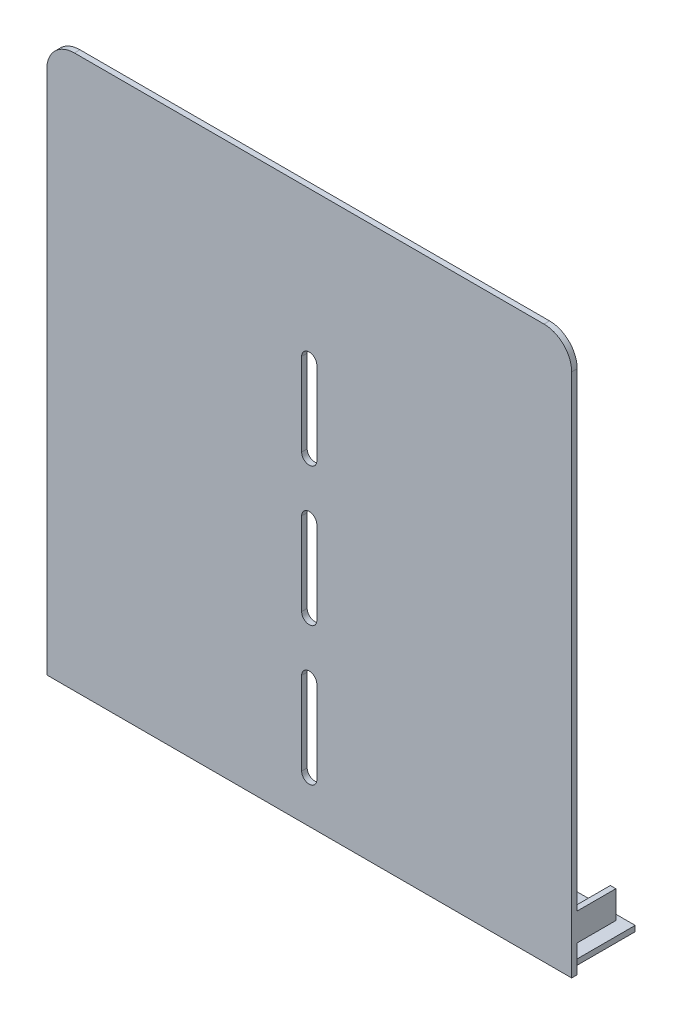
from build123d import *

# Parameters (mm, degrees)
SKETCH_1_W          = 190
SKETCH_1_H          = 200
EXTRUDE_1_DEPTH     = 2
SKETCH_2_W          = 42
SKETCH_2_H          = 24
EXTRUDE_2_DEPTH     = 2
SKETCH_12_W         = 14
SKETCH_12_H         = 10
EXTRUDE_5_DEPTH     = 2
SKETCH_15_W         = 14
SKETCH_15_H         = 15
EXTRUDE_9_DEPTH     = 2
SKETCH_15_3_W       = 2
SKETCH_15_3_H       = 15
EXTRUDE_10_DEPTH    = 190
CUT_EXTRUDE_1_DEPTH = 20
FILLET_1_R          = 10
SKETCH_20_W         = 14
SKETCH_20_H         = 125
CUT_EXTRUDE_4_DEPTH = 10
SKETCH_21_W         = 145
SKETCH_21_H         = 70
CUT_EXTRUDE_5_DEPTH = 2
SKETCH_22_W         = 2
SKETCH_22_H         = 10
EXTRUDE_11_DEPTH    = 14
SKETCH_23_W         = 15
SKETCH_23_H         = 16
EXTRUDE_12_DEPTH    = 2
SKETCH_25_W         = 15
SKETCH_25_H         = 2
EXTRUDE_13_DEPTH    = 43


with BuildPart() as part:
    # 草图1 → 凸台-拉伸1 (new body)
    with BuildSketch(Plane.XY):
        with Locations((95, 100)):
            Rectangle(SKETCH_1_W, SKETCH_1_H)
    extrude(amount=EXTRUDE_1_DEPTH)

    # 草图2 → 凸台-拉伸2 (add)
    with BuildSketch(Plane(origin=(0, 0, 0), x_dir=(1, 0, 0), z_dir=(0, 1, 0))):
        with Locations((24, 12)):
            Rectangle(SKETCH_2_W, SKETCH_2_H)
        with Locations((166, 12)):
            Rectangle(SKETCH_2_W, SKETCH_2_H)
    extrude(amount=EXTRUDE_2_DEPTH)

    # 草图15 → 凸台-拉伸9 (add)
    with BuildSketch(Plane(origin=(0, 0, 0), x_dir=(0, 0, -1), z_dir=(1, 0, 0))):
        with Locations((7, 127.5)):
            Rectangle(SKETCH_15_W, SKETCH_15_H)
        with Locations((7, 72.5)):
            Rectangle(SKETCH_15_W, SKETCH_15_H)
    extrude_9 = extrude(amount=EXTRUDE_9_DEPTH)

    # 草图15<3> → 凸台-拉伸10 (add)
    with BuildSketch(Plane(origin=(0, 0, 0), x_dir=(0, 0, -1), z_dir=(1, 0, 0))):
        with Locations((15, 127.5)):
            Rectangle(SKETCH_15_3_W, SKETCH_15_3_H)
        with Locations((15, 72.5)):
            Rectangle(SKETCH_15_3_W, SKETCH_15_3_H)
    extrude_10 = extrude(amount=EXTRUDE_10_DEPTH)

    # 草图17 → 切除-拉伸1 (cut)
    with BuildSketch(Plane(origin=(0, 0, 0), x_dir=(-1, 0, 0), z_dir=(0, 0, -1))):
        with BuildLine():
            Line((-95, 146), (-95, 116))
            Line((-95, 116), (-95, 113.25))
            ThreePointArc((-95, 113.25), (-93.055456352, 114.055456352), (-92.25, 116))
            Line((-92.25, 116), (-92.25, 146))
            ThreePointArc((-92.25, 146), (-93.055456352, 147.944543648), (-95, 148.75))
            Line((-95, 148.75), (-95, 146))
        make_face()
        with BuildLine():
            Line((-95, 113.25), (-95, 116))
            Line((-95, 116), (-95, 146))
            Line((-95, 146), (-95, 148.75))
            ThreePointArc((-95, 148.75), (-96.944543648, 147.944543648), (-97.75, 146))
            Line((-97.75, 146), (-97.75, 116))
            ThreePointArc((-97.75, 116), (-96.944543648, 114.055456352), (-95, 113.25))
        make_face()
        with BuildLine():
            Line((-95, 63.25), (-95, 98.75))
            ThreePointArc((-95, 98.75), (-96.944543648, 97.944543648), (-97.75, 96))
            Line((-97.75, 96), (-97.75, 66))
            ThreePointArc((-97.75, 66), (-96.944543648, 64.055456352), (-95, 63.25))
        make_face()
        with BuildLine():
            Line((-95, 13.25), (-95, 48.75))
            ThreePointArc((-95, 48.75), (-96.944543648, 47.944543648), (-97.75, 46))
            Line((-97.75, 46), (-97.75, 16))
            ThreePointArc((-97.75, 16), (-96.944543648, 14.055456352), (-95, 13.25))
        make_face()
        with BuildLine():
            ThreePointArc((-92.25, 46), (-93.055456352, 47.944543648), (-95, 48.75))
            Line((-95, 48.75), (-95, 13.25))
            ThreePointArc((-95, 13.25), (-93.055456352, 14.055456352), (-92.25, 16))
            Line((-92.25, 16), (-92.25, 46))
        make_face()
        with BuildLine():
            ThreePointArc((-92.25, 96), (-93.055456352, 97.944543648), (-95, 98.75))
            Line((-95, 98.75), (-95, 63.25))
            ThreePointArc((-95, 63.25), (-93.055456352, 64.055456352), (-92.25, 66))
            Line((-92.25, 66), (-92.25, 96))
        make_face()
    extrude(amount=-CUT_EXTRUDE_1_DEPTH, mode=Mode.SUBTRACT)

    # 圆角1
    fillet_1_edges = [part.edges().sort_by_distance(p)[0] for p in [
        (0, 200, 1),
        (190, 200, 1),
    ]]
    fillet(fillet_1_edges, radius=FILLET_1_R)

    # 镜向18: 凸台-拉伸9, 凸台-拉伸10 across plane
    add(extrude_9.mirror(Plane(origin=(95, 0, 0), x_dir=(0, 0, 1), z_dir=(1, 0, 0))))
    add(extrude_10.mirror(Plane(origin=(95, 0, 0), x_dir=(0, 0, 1), z_dir=(1, 0, 0))))


with BuildPart() as body_2:
    # 草图12 → 凸台-拉伸5 (new body)
    with BuildSketch(Plane(origin=(0, 0, 0), x_dir=(0, 0, -1), z_dir=(1, 0, 0))):
        with Locations((7, 15)):
            Rectangle(SKETCH_12_W, SKETCH_12_H)
    extrude_5 = extrude(amount=EXTRUDE_5_DEPTH)


with BuildPart() as part_1:
    add(part.part)

    # 镜向19: 凸台-拉伸5 across plane
    add(extrude_5.mirror(Plane(origin=(95, 0, 0), x_dir=(0, 0, 1), z_dir=(1, 0, 0))))

    # 草图20 → 切除-拉伸4 (cut)
    with BuildSketch(Plane(origin=(190, 0, 0), x_dir=(0, 0, -1), z_dir=(1, 0, 0))):
        with Locations((7, 72.5)):
            Rectangle(SKETCH_20_W, SKETCH_20_H)
    extrude(amount=-CUT_EXTRUDE_4_DEPTH, mode=Mode.SUBTRACT)

    # 草图21 → 切除-拉伸5 (cut)
    with BuildSketch(Plane(origin=(0, 0, -16), x_dir=(-1, 0, 0), z_dir=(0, 0, -1))):
        with Locations((-117.5, 100)):
            Rectangle(SKETCH_21_W, SKETCH_21_H)
    extrude(amount=-CUT_EXTRUDE_5_DEPTH, mode=Mode.SUBTRACT)

    # 草图22 → 凸台-拉伸11 (add)
    with BuildSketch(Plane(origin=(0, 0, 0), x_dir=(-1, 0, 0), z_dir=(0, 0, -1))):
        with Locations((-189, 15)):
            Rectangle(SKETCH_22_W, SKETCH_22_H)
    extrude(amount=EXTRUDE_11_DEPTH)

    # 草图23 → 凸台-拉伸12 (add)
    with BuildSketch(Plane.XZ):
        with Locations((62.5, -8)):
            Rectangle(SKETCH_23_W, SKETCH_23_H)
        with Locations((127.5, -8)):
            Rectangle(SKETCH_23_W, SKETCH_23_H)
    extrude(amount=-EXTRUDE_12_DEPTH)

    # 草图25 → 凸台-拉伸13 (add)
    with BuildSketch(Plane(origin=(0, 2, 0), x_dir=(1, 0, 0), z_dir=(0, 1, 0))):
        with Locations((62.5, 15)):
            Rectangle(SKETCH_25_W, SKETCH_25_H)
        with Locations((127.5, 15)):
            Rectangle(SKETCH_25_W, SKETCH_25_H)
    extrude(amount=EXTRUDE_13_DEPTH)


solid = Compound([body_2.part, part_1.part])
